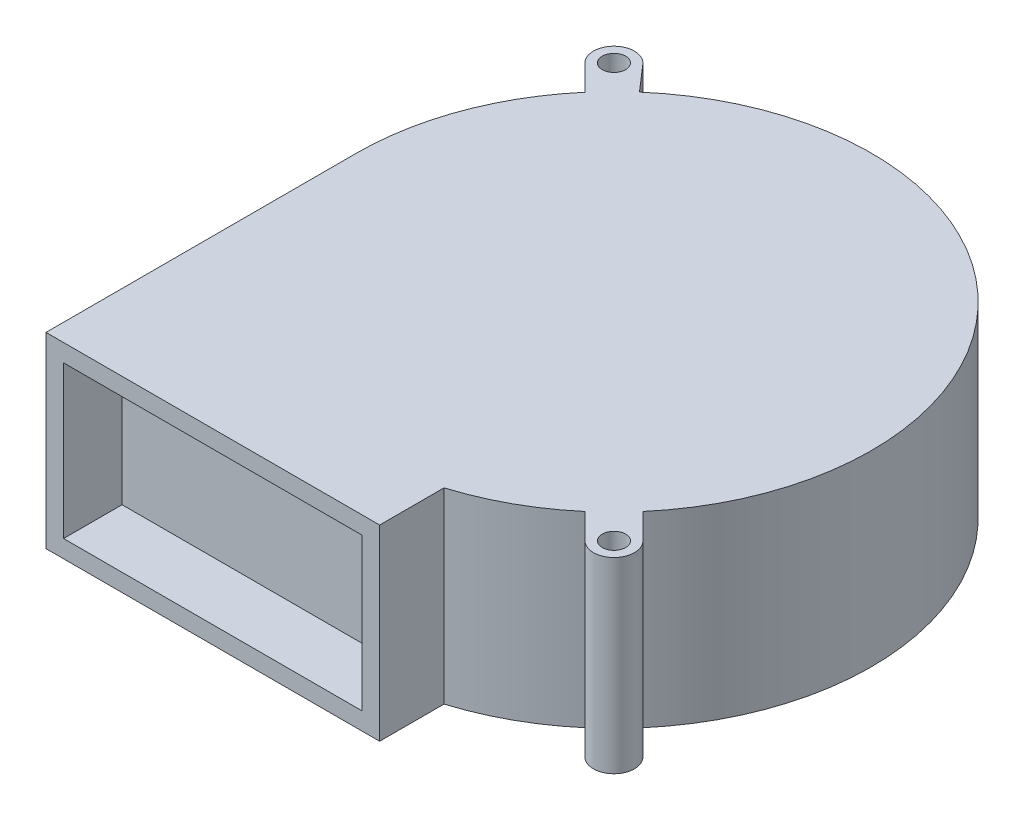
from build123d import *

# Parameters (mm, degrees)
CROQUIS1_R              = 2
SALIENTE_EXTRUIR1_DEPTH = 32
CROQUIS2_W              = 51
CROQUIS2_H              = 26
CORTAR_EXTRUIR1_DEPTH   = 10


with BuildPart() as part:
    # Croquis1 → Saliente-Extruir1 (new body)
    with BuildSketch(Plane(origin=(0, 0, 0), x_dir=(1, 0, 0), z_dir=(0, 1, 0))):
        with BuildLine():
            Line((-37.830212793, 32.880465325), (-33.488983426, 28.539235958))
            ThreePointArc((-33.488983426, 28.539235958), (-41.28871075, 15.206655274), (-44, 0))
            Line((-44, 0), (-44, -53.035699114))
            Line((-44, -53.035699114), (13, -53.035699114))
            Line((13, -53.035699114), (13, -42.035699114))
            ThreePointArc((13, -42.035699114), (21.204683875, -38.553357594), (28.539235958, -33.488983426))
            Line((28.539235958, -33.488983426), (32.880465325, -37.830212793))
            ThreePointArc((32.880465325, -37.830212793), (37.830212793, -37.830212793), (37.830212793, -32.880465325))
            Line((37.830212793, -32.880465325), (33.488983426, -28.539235958))
            ThreePointArc((33.488983426, -28.539235958), (30.963432731, 31.261251311), (-28.858489769, 33.214267541))
            Line((-28.858489769, 33.214267541), (-32.71329505, 37.650900745))
            ThreePointArc((-32.71329505, 37.650900745), (-37.742020856, 37.915368356), (-37.830212793, 32.880465325))
        make_face()
        with Locations(Location((-35.355339059, 35.355339059, 0), (0, 0, 270))):
            Circle(CROQUIS1_R, mode=Mode.SUBTRACT)
        with Locations(Location((35.355339059, -35.355339059, 0), (0, 0, 270))):
            Circle(CROQUIS1_R, mode=Mode.SUBTRACT)
    extrude(amount=SALIENTE_EXTRUIR1_DEPTH)

    # Croquis2 → Cortar-Extruir1 (cut)
    with BuildSketch(Plane.XY.offset(53.035699114)):
        with Locations((-15.5, 16)):
            Rectangle(CROQUIS2_W, CROQUIS2_H)
    extrude(amount=-CORTAR_EXTRUIR1_DEPTH, mode=Mode.SUBTRACT)


solid = part.part
